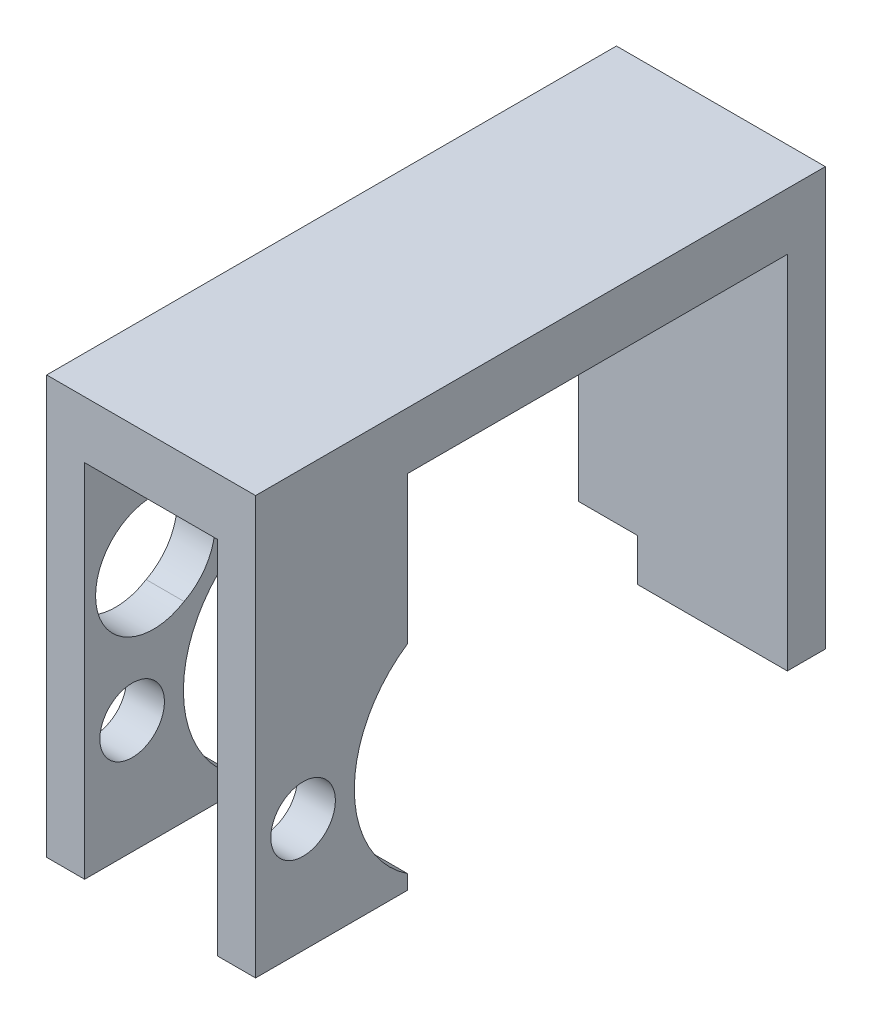
from build123d import *

# Parameters (mm, degrees)
REAR_LOCK_EAR_SKETCH_W             = 2
REAR_LOCK_EAR_SKETCH_H             = 22
REAR_LOCK_EAR_DEPTH                = 8
LOCK_FORK_WEB_SKETCH_W             = 11
LOCK_FORK_WEB_SKETCH_H             = 3
LOCK_FORK_WEB_DEPTH                = 30
FRONT_LOCK_EAR_SKETCH_W            = 2
FRONT_LOCK_EAR_SKETCH_H            = 22
FRONT_LOCK_EAR_DEPTH               = 8
FORK_MOUNTING_FOOT_SKETCH_W        = 11
FORK_MOUNTING_FOOT_SKETCH_H        = 22
FORK_MOUNTING_FOOT_DEPTH           = 2
COUPLING_BARREL_CLEARANCE_SKETCH_R = 6.3
COUPLING_BARREL_CLEARANCE_DEPTH    = 11.3
SERVICE_PIN_CLEARANCE_1_SKETCH_R   = 1.7
SERVICE_PIN_CLEARANCE_1_DEPTH      = 2.3
SERVICE_PIN_CLEARANCE_2_SKETCH_R   = 1.7
SERVICE_PIN_CLEARANCE_2_DEPTH      = 2.3
MOTOR_HEAD_ACCESS_1_1_SKETCH_R     = 3
MOTOR_HEAD_ACCESS_1_1_DEPTH        = 3.2
MOTOR_HEAD_ACCESS_1_5_SKETCH_R     = 3
MOTOR_HEAD_ACCESS_1_5_DEPTH        = 3.2
MOTOR_HEAD_ACCESS_2_1_SKETCH_R     = 3.05
MOTOR_HEAD_ACCESS_2_1_DEPTH        = 3.2
MOTOR_HEAD_ACCESS_2_5_SKETCH_R     = 3.05
MOTOR_HEAD_ACCESS_2_5_DEPTH        = 3.2


with BuildPart() as part:
    # Rear lock ear sketch → Rear lock ear (new body)
    with BuildSketch(Plane.XY.offset(-16)):
        with Locations((-11, -34)):
            Rectangle(REAR_LOCK_EAR_SKETCH_W, REAR_LOCK_EAR_SKETCH_H)
    extrude(amount=REAR_LOCK_EAR_DEPTH)

    # Lock fork web sketch → Lock fork web (add)
    with BuildSketch(Plane.XY.offset(-38)):
        with Locations((-6.5, -43.5)):
            Rectangle(LOCK_FORK_WEB_SKETCH_W, LOCK_FORK_WEB_SKETCH_H)
    extrude(amount=LOCK_FORK_WEB_DEPTH)

    # Front lock ear sketch → Front lock ear (add)
    with BuildSketch(Plane.XY.offset(-16)):
        with Locations((-2, -34)):
            Rectangle(FRONT_LOCK_EAR_SKETCH_W, FRONT_LOCK_EAR_SKETCH_H)
    extrude(amount=FRONT_LOCK_EAR_DEPTH)

    # Fork mounting foot sketch → Fork mounting foot (add)
    with BuildSketch(Plane.XY.offset(-38)):
        with Locations((-6.5, -34)):
            Rectangle(FORK_MOUNTING_FOOT_SKETCH_W, FORK_MOUNTING_FOOT_SKETCH_H)
    extrude(amount=FORK_MOUNTING_FOOT_DEPTH)

    # Coupling barrel clearance sketch → Coupling barrel clearance (cut)
    with BuildSketch(Plane(origin=(-12.1, 0, 0), x_dir=(0, 0, -1), z_dir=(1, 0, 0))):
        with Locations((19.5, -29)):
            Circle(COUPLING_BARREL_CLEARANCE_SKETCH_R)
    extrude(amount=COUPLING_BARREL_CLEARANCE_DEPTH, mode=Mode.SUBTRACT)

    # Service pin clearance 1 sketch → Service pin clearance 1 (cut)
    with BuildSketch(Plane(origin=(-12.1, 0, 0), x_dir=(0, 0, -1), z_dir=(1, 0, 0))):
        with Locations(Location((10.5, -29, 0), (0, 0, 180))):
            Circle(SERVICE_PIN_CLEARANCE_1_SKETCH_R)
    extrude(amount=SERVICE_PIN_CLEARANCE_1_DEPTH, mode=Mode.SUBTRACT)

    # Service pin clearance 2 sketch → Service pin clearance 2 (cut)
    with BuildSketch(Plane(origin=(-3.1, 0, 0), x_dir=(0, 0, -1), z_dir=(1, 0, 0))):
        with Locations(Location((10.5, -29, 0), (0, 0, 180))):
            Circle(SERVICE_PIN_CLEARANCE_2_SKETCH_R)
    extrude(amount=SERVICE_PIN_CLEARANCE_2_DEPTH, mode=Mode.SUBTRACT)

    # Motor head access 1-1 sketch → Motor head access 1-1 (cut)
    with BuildSketch(Plane(origin=(-12.1, 0, 0), x_dir=(0, 0, -1), z_dir=(1, 0, 0))):
        with Locations((34.765, -22.5)):
            Circle(MOTOR_HEAD_ACCESS_1_1_SKETCH_R)
    extrude(amount=MOTOR_HEAD_ACCESS_1_1_DEPTH, mode=Mode.SUBTRACT)

    # Motor head access 1-5 sketch → Motor head access 1-5 (cut)
    with BuildSketch(Plane(origin=(-12.1, 0, 0), x_dir=(0, 0, -1), z_dir=(1, 0, 0))):
        with Locations(Location((11.8675, -35.719877789, 0), (0, 0, 180))):
            Circle(MOTOR_HEAD_ACCESS_1_5_SKETCH_R)
    extrude(amount=MOTOR_HEAD_ACCESS_1_5_DEPTH, mode=Mode.SUBTRACT)

    # Motor head access 2-1 sketch → Motor head access 2-1 (cut)
    with BuildSketch(Plane(origin=(-12.1, 0, 0), x_dir=(0, 0, -1), z_dir=(1, 0, 0))):
        with Locations((35.25, -22)):
            Circle(MOTOR_HEAD_ACCESS_2_1_SKETCH_R)
    extrude(amount=MOTOR_HEAD_ACCESS_2_1_DEPTH, mode=Mode.SUBTRACT)

    # Motor head access 2-5 sketch → Motor head access 2-5 (cut)
    with BuildSketch(Plane(origin=(-12.1, 0, 0), x_dir=(0, 0, -1), z_dir=(1, 0, 0))):
        with Locations((11.625, -35.63990011)):
            Circle(MOTOR_HEAD_ACCESS_2_5_SKETCH_R)
    extrude(amount=MOTOR_HEAD_ACCESS_2_5_DEPTH, mode=Mode.SUBTRACT)


with BuildPart() as body_2:
    # Mirror1: mirrored copy
    add(part.part.mirror(Plane(origin=(0, 0, 0), x_dir=(0, 0, 1), z_dir=(0, -1, 0))))


solid = body_2.part
